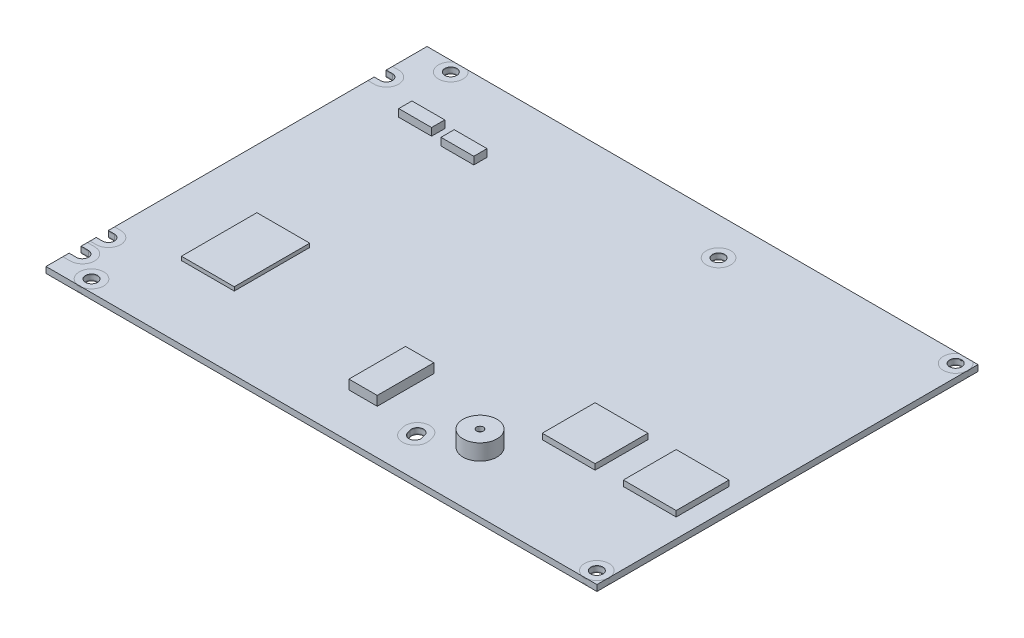
from build123d import *

# Parameters (mm, degrees)
CROQUIS1_R            = 1.6
EXTRUIR1_DEPTH        = 1.6
CROQUIS2_R            = 3.25
CORTAR_EXTRUIR1_DEPTH = 0.2
CROQUIS3_R            = 3.25
CROQUIS3_R_2          = 1.6
EXTRUIR2_DEPTH        = 0.2
EXTRUIR2_2_DEPTH      = 0.2
EXTRUIR2_3_DEPTH      = 0.2
EXTRUIR2_4_DEPTH      = 0.2
EXTRUIR2_5_DEPTH      = 0.2
EXTRUIR2_6_DEPTH      = 0.2
EXTRUIR2_7_DEPTH      = 0.2
EXTRUIR2_8_DEPTH      = 0.2
CROQUIS3_R_3          = 1.606150229
EXTRUIR2_9_DEPTH      = 0.2
CROQUIS4_W            = 14
CROQUIS4_H            = 20
EXTRUIR3_DEPTH        = 1
CROQUIS5_W            = 14
CROQUIS5_H            = 14
EXTRUIR4_DEPTH        = 1.5
EXTRUIR4_2_DEPTH      = 1.5
CROQUIS6_W            = 7.5
CROQUIS6_H            = 15
EXTRUIR5_DEPTH        = 2.5
CROQUIS7_R            = 1
CORTAR_EXTRUIR2_DEPTH = 0.2
CROQUIS8_W            = 8.7
CROQUIS8_H            = 3.5
EXTRUIR6_DEPTH        = 2
EXTRUIR6_2_DEPTH      = 2
CROQUIS9_R            = 4.5
EXTRUIR7_DEPTH        = 4.2
CROQUIS10_R           = 0.915294026
CORTAR_EXTRUIR3_DEPTH = 1.2


with BuildPart() as part:
    # Croquis1 → Extruir1 (new body)
    with BuildSketch(Plane(origin=(0, 0, 0), x_dir=(1, 0, 0), z_dir=(0, 1, 0))):
        with BuildLine():
            Line((0, -14.02), (0, -84.48))
            Line((0, -84.48), (1.64, -84.48))
            ThreePointArc((1.64, -84.48), (3.24, -86.08), (1.64, -87.68))
            Line((1.64, -87.68), (0, -87.68))
            Line((0, -87.68), (0, -91.68))
            Line((0, -91.68), (1.93, -91.68))
            ThreePointArc((1.93, -91.68), (3.53, -93.28), (1.93, -94.88))
            Line((1.93, -94.88), (0, -94.88))
            Line((0, -94.88), (0, -101))
            Line((0, -101), (146.04, -101))
            Line((146.04, -101), (146.04, 0))
            Line((146.04, 0), (0, 0))
            Line((0, 0), (0, -10.82))
            Line((0, -10.82), (1.64, -10.82))
            ThreePointArc((1.64, -10.82), (3.24, -12.42), (1.64, -14.02))
            Line((1.64, -14.02), (0, -14.02))
        make_face()
        with Locations(Location((8.99, -2.7, 0), (0, 0, 270))):
            Circle(CROQUIS1_R, mode=Mode.SUBTRACT)
        with Locations(Location((87.15, -9.88, 0), (0, 0, 270))):
            Circle(CROQUIS1_R, mode=Mode.SUBTRACT)
        with Locations(Location((142.8, -2.68, 0), (0, 0, 270))):
            Circle(CROQUIS1_R, mode=Mode.SUBTRACT)
        with Locations(Location((8.89, -97.82, 0), (0, 0, 270))):
            Circle(CROQUIS1_R, mode=Mode.SUBTRACT)
        with Locations(Location((142.8, -97.8, 0), (0, 0, 270))):
            Circle(CROQUIS1_R, mode=Mode.SUBTRACT)
        with BuildLine():
            Line((88.899048168, -89.45258631), (89.169048168, -90.40258631))
            ThreePointArc((89.169048168, -90.40258631), (88.06741369, -92.379048168), (86.090951832, -91.27741369))
            Line((86.090951832, -91.27741369), (85.820951832, -90.32741369))
            ThreePointArc((85.820951832, -90.32741369), (86.92258631, -88.350951832), (88.899048168, -89.45258631))
        make_face(mode=Mode.SUBTRACT)
    extrude(amount=EXTRUIR1_DEPTH)

    # Croquis2 → Cortar-Extruir1 (cut)
    with BuildSketch(Plane(origin=(0, 1.6, 0), x_dir=(1, 0, 0), z_dir=(0, 1, 0))):
        with Locations((8.99, -2.7)):
            Circle(CROQUIS2_R)
        with Locations((8.89, -97.82)):
            Circle(CROQUIS2_R)
        with Locations(Location((87.15, -9.88, 0), (0, 0, 270))):
            Circle(CROQUIS2_R)
        with Locations((142.8, -2.68)):
            Circle(CROQUIS2_R)
        with Locations((142.8, -97.8)):
            Circle(CROQUIS2_R)
        with BuildLine():
            Line((1.64, -9.17), (-2.325776784, -9.17))
            Line((-2.325776784, -9.17), (-2.325776784, -15.67))
            Line((-2.325776784, -15.67), (1.64, -15.67))
            ThreePointArc((1.64, -15.67), (4.89, -12.42), (1.64, -9.17))
        make_face()
        with BuildLine():
            Line((1.64, -82.83), (-3.18425811, -82.83))
            Line((-3.18425811, -82.83), (-3.18425811, -89.33))
            Line((-3.18425811, -89.33), (1.64, -89.33))
            ThreePointArc((1.64, -89.33), (4.89, -86.08), (1.64, -82.83))
        make_face()
        with BuildLine():
            Line((1.93, -90.03), (-3.18425811, -90.03))
            Line((-3.18425811, -90.03), (-3.18425811, -96.53))
            Line((-3.18425811, -96.53), (1.93, -96.53))
            ThreePointArc((1.93, -96.53), (5.18, -93.28), (1.93, -90.03))
        make_face()
        with BuildLine():
            Line((90.486191592, -89.001503442), (90.756191592, -89.951503442))
            ThreePointArc((90.756191592, -89.951503442), (88.518496558, -93.966191592), (84.503808408, -91.728496558))
            Line((84.503808408, -91.728496558), (84.233808408, -90.778496558))
            ThreePointArc((84.233808408, -90.778496558), (86.471503442, -86.763808408), (90.486191592, -89.001503442))
        make_face()
    cortar_extruir1 = extrude(amount=-CORTAR_EXTRUIR1_DEPTH, mode=Mode.SUBTRACT)

    # Simetría1: Cortar-Extruir1 across plane
    add(cortar_extruir1.mirror(Plane.ZX.offset(0.8)), mode=Mode.SUBTRACT)

    # Croquis7 → Cortar-Extruir2 (cut)
    with BuildSketch(Plane.XZ):
        with Locations(Location((17.46, 62.99, 0), (0, 0, 270))):
            Circle(CROQUIS7_R)
        with Locations(Location((57.62, 62.99, 0), (0, 0, 270))):
            Circle(CROQUIS7_R)
    extrude(amount=-CORTAR_EXTRUIR2_DEPTH, mode=Mode.SUBTRACT)


with BuildPart() as body_2:
    # Croquis3 → Extruir2 (new body)
    with BuildSketch(Plane(origin=(0, 1.4, 0), x_dir=(1, 0, 0), z_dir=(0, 1, 0))):
        with Locations(Location((87.15, -9.88, 0), (0, 0, 270))):
            Circle(CROQUIS3_R)
        with Locations(Location((87.15, -9.88, 0), (0, 0, 270))):
            Circle(CROQUIS3_R_2, mode=Mode.SUBTRACT)
    extrude(amount=EXTRUIR2_DEPTH)


with BuildPart() as body_3:
    # Croquis3 → Extruir2 2 (new body)
    with BuildSketch(Plane(origin=(0, 1.4, 0), x_dir=(1, 0, 0), z_dir=(0, 1, 0))):
        with BuildLine():
            Line((8.219105075, -101), (9.560894925, -101))
            ThreePointArc((9.560894925, -101), (8.89, -94.57), (8.219105075, -101))
        make_face()
        with Locations(Location((8.89, -97.82, 0), (0, 0, 270))):
            Circle(CROQUIS3_R_2, mode=Mode.SUBTRACT)
    extrude(amount=EXTRUIR2_2_DEPTH)


with BuildPart() as body_4:
    # Croquis3 → Extruir2 3 (new body)
    with BuildSketch(Plane(origin=(0, 1.4, 0), x_dir=(1, 0, 0), z_dir=(0, 1, 0))):
        with BuildLine():
            Line((0, -90.03), (0, -91.68))
            Line((0, -91.68), (1.93, -91.68))
            ThreePointArc((1.93, -91.68), (3.53, -93.28), (1.93, -94.88))
            Line((1.93, -94.88), (0, -94.88))
            Line((0, -94.88), (0, -96.53))
            Line((0, -96.53), (1.93, -96.53))
            ThreePointArc((1.93, -96.53), (5.18, -93.28), (1.93, -90.03))
            Line((1.93, -90.03), (0, -90.03))
        make_face()
    extrude(amount=EXTRUIR2_3_DEPTH)


with BuildPart() as body_5:
    # Croquis3 → Extruir2 4 (new body)
    with BuildSketch(Plane(origin=(0, 1.4, 0), x_dir=(1, 0, 0), z_dir=(0, 1, 0))):
        with BuildLine():
            Line((84.233808408, -90.778496558), (84.503808408, -91.728496558))
            ThreePointArc((84.503808408, -91.728496558), (88.518496558, -93.966191592), (90.756191592, -89.951503442))
            Line((90.756191592, -89.951503442), (90.486191592, -89.001503442))
            ThreePointArc((90.486191592, -89.001503442), (86.471503442, -86.763808408), (84.233808408, -90.778496558))
        make_face()
        with BuildLine():
            Line((85.820951832, -90.32741369), (86.090951832, -91.27741369))
            ThreePointArc((86.090951832, -91.27741369), (88.06741369, -92.379048168), (89.169048168, -90.40258631))
            Line((89.169048168, -90.40258631), (88.899048168, -89.45258631))
            ThreePointArc((88.899048168, -89.45258631), (86.92258631, -88.350951832), (85.820951832, -90.32741369))
        make_face(mode=Mode.SUBTRACT)
    extrude(amount=EXTRUIR2_4_DEPTH)


with BuildPart() as body_6:
    # Croquis3 → Extruir2 5 (new body)
    with BuildSketch(Plane(origin=(0, 1.4, 0), x_dir=(1, 0, 0), z_dir=(0, 1, 0))):
        with BuildLine():
            Line((0, -82.83), (0, -84.48))
            Line((0, -84.48), (1.64, -84.48))
            ThreePointArc((1.64, -84.48), (3.24, -86.08), (1.64, -87.68))
            Line((1.64, -87.68), (0, -87.68))
            Line((0, -87.68), (0, -89.33))
            Line((0, -89.33), (1.64, -89.33))
            ThreePointArc((1.64, -89.33), (4.89, -86.08), (1.64, -82.83))
            Line((1.64, -82.83), (0, -82.83))
        make_face()
    extrude(amount=EXTRUIR2_5_DEPTH)


with BuildPart() as body_7:
    # Croquis3 → Extruir2 6 (new body)
    with BuildSketch(Plane(origin=(0, 1.4, 0), x_dir=(1, 0, 0), z_dir=(0, 1, 0))):
        with BuildLine():
            Line((142.232109165, -101), (143.367890835, -101))
            ThreePointArc((143.367890835, -101), (145.206995118, -99.983775287), (146.04, -98.054754784))
            Line((146.04, -98.054754784), (146.04, -97.545245216))
            ThreePointArc((146.04, -97.545245216), (140.616224713, -95.393004882), (142.232109165, -101))
        make_face()
        with Locations(Location((142.8, -97.8, 0), (0, 0, 270))):
            Circle(CROQUIS3_R_2, mode=Mode.SUBTRACT)
    extrude(amount=EXTRUIR2_6_DEPTH)


with BuildPart() as body_8:
    # Croquis3 → Extruir2 7 (new body)
    with BuildSketch(Plane(origin=(0, 1.4, 0), x_dir=(1, 0, 0), z_dir=(0, 1, 0))):
        with BuildLine():
            Line((10.799005252, 0), (7.180994748, 0))
            ThreePointArc((7.180994748, 0), (8.99, -5.95), (10.799005252, 0))
        make_face()
        with Locations(Location((8.99, -2.7, 0), (0, 0, 270))):
            Circle(CROQUIS3_R_2, mode=Mode.SUBTRACT)
    extrude(amount=EXTRUIR2_7_DEPTH)


with BuildPart() as body_9:
    # Croquis3 → Extruir2 8 (new body)
    with BuildSketch(Plane(origin=(0, 1.4, 0), x_dir=(1, 0, 0), z_dir=(0, 1, 0))):
        with BuildLine():
            Line((0, -9.17), (0, -10.82))
            Line((0, -10.82), (1.64, -10.82))
            ThreePointArc((1.64, -10.82), (3.24, -12.42), (1.64, -14.02))
            Line((1.64, -14.02), (0, -14.02))
            Line((0, -14.02), (0, -15.67))
            Line((0, -15.67), (1.64, -15.67))
            ThreePointArc((1.64, -15.67), (4.89, -12.42), (1.64, -9.17))
            Line((1.64, -9.17), (0, -9.17))
        make_face()
    extrude(amount=EXTRUIR2_8_DEPTH)


with BuildPart() as body_10:
    # Croquis3 → Extruir2 9 (new body)
    with BuildSketch(Plane(origin=(0, 1.4, 0), x_dir=(1, 0, 0), z_dir=(0, 1, 0))):
        with BuildLine():
            Line((146.04, -2.934754784), (146.04, -2.425245216))
            ThreePointArc((146.04, -2.425245216), (145.61393966, -1.053886969), (144.638504827, 0))
            Line((144.638504827, 0), (140.961495173, 0))
            ThreePointArc((140.961495173, 0), (141.173886969, -5.49393966), (146.04, -2.934754784))
        make_face()
        with Locations(Location((142.8, -2.68, 0), (0, 0, 270))):
            Circle(CROQUIS3_R_3, mode=Mode.SUBTRACT)
    extrude(amount=EXTRUIR2_9_DEPTH)


with BuildPart() as body_11:
    # Simetría2: mirrored copy
    add(body_4.part.mirror(Plane.ZX.offset(0.8)))


with BuildPart() as body_12:
    # Simetr_a2 2: mirrored copy
    add(body_6.part.mirror(Plane.ZX.offset(0.8)))


with BuildPart() as body_13:
    # Simetr_a2 3: mirrored copy
    add(body_3.part.mirror(Plane.ZX.offset(0.8)))


with BuildPart() as body_14:
    # Simetr_a2 4: mirrored copy
    add(body_8.part.mirror(Plane.ZX.offset(0.8)))


with BuildPart() as body_15:
    # Simetr_a2 5: mirrored copy
    add(body_9.part.mirror(Plane.ZX.offset(0.8)))


with BuildPart() as body_16:
    # Simetr_a2 6: mirrored copy
    add(body_7.part.mirror(Plane.ZX.offset(0.8)))


with BuildPart() as body_17:
    # Simetr_a2 7: mirrored copy
    add(body_5.part.mirror(Plane.ZX.offset(0.8)))


with BuildPart() as body_18:
    # Simetr_a2 8: mirrored copy
    add(body_2.part.mirror(Plane.ZX.offset(0.8)))


with BuildPart() as body_19:
    # Simetr_a2 9: mirrored copy
    add(body_10.part.mirror(Plane.ZX.offset(0.8)))


with BuildPart() as body_20:
    # Croquis4 → Extruir3 (new body)
    with BuildSketch(Plane(origin=(0, 1.6, 0), x_dir=(1, 0, 0), z_dir=(0, 1, 0))):
        with Locations((23.6, -71.7)):
            Rectangle(CROQUIS4_W, CROQUIS4_H)
    extrude(amount=EXTRUIR3_DEPTH)


with BuildPart() as body_21:
    # Croquis5 → Extruir4 (new body)
    with BuildSketch(Plane(origin=(0, 1.6, 0), x_dir=(1, 0, 0), z_dir=(0, 1, 0))):
        with Locations((112.54, -68)):
            Rectangle(CROQUIS5_W, CROQUIS5_H)
    extrude(amount=EXTRUIR4_DEPTH)


with BuildPart() as body_22:
    # Croquis5 → Extruir4 2 (new body)
    with BuildSketch(Plane(origin=(0, 1.6, 0), x_dir=(1, 0, 0), z_dir=(0, 1, 0))):
        with Locations((134.04, -68)):
            Rectangle(CROQUIS5_W, CROQUIS5_H)
    extrude(amount=EXTRUIR4_2_DEPTH)


with BuildPart() as body_23:
    # Croquis6 → Extruir5 (new body)
    with BuildSketch(Plane(origin=(0, 1.6, 0), x_dir=(1, 0, 0), z_dir=(0, 1, 0))):
        with Locations((72.25, -81.7)):
            Rectangle(CROQUIS6_W, CROQUIS6_H)
    extrude(amount=EXTRUIR5_DEPTH)


with BuildPart() as body_24:
    # Croquis8 → Extruir6 (new body)
    with BuildSketch(Plane(origin=(0, 1.6, 0), x_dir=(1, 0, 0), z_dir=(0, 1, 0))):
        with Locations((29.05, -19.25)):
            Rectangle(CROQUIS8_W, CROQUIS8_H)
    extrude(amount=EXTRUIR6_DEPTH)


with BuildPart() as body_25:
    # Croquis8 → Extruir6 2 (new body)
    with BuildSketch(Plane(origin=(0, 1.6, 0), x_dir=(1, 0, 0), z_dir=(0, 1, 0))):
        with Locations((16.85, -18.25)):
            Rectangle(CROQUIS8_W, CROQUIS8_H)
    extrude(amount=EXTRUIR6_2_DEPTH)


with BuildPart() as body_26:
    # Croquis9 → Extruir7 (new body)
    with BuildSketch(Plane(origin=(0, 1.6, 0), x_dir=(1, 0, 0), z_dir=(0, 1, 0))):
        with Locations(Location((99.04, -85, 0), (0, 0, 270))):
            Circle(CROQUIS9_R)
    extrude(amount=EXTRUIR7_DEPTH)

    # Croquis10 → Cortar-Extruir3 (cut)
    with BuildSketch(Plane(origin=(0, 5.8, 0), x_dir=(1, 0, 0), z_dir=(0, 1, 0))):
        with Locations(Location((99.04, -85, 0), (0, 0, 270))):
            Circle(CROQUIS10_R)
    extrude(amount=-CORTAR_EXTRUIR3_DEPTH, mode=Mode.SUBTRACT)


solid = Compound([part.part, body_2.part, body_3.part, body_4.part, body_5.part, body_6.part, body_7.part, body_8.part, body_9.part, body_10.part, body_11.part, body_12.part, body_13.part, body_14.part, body_15.part, body_16.part, body_17.part, body_18.part, body_19.part, body_20.part, body_21.part, body_22.part, body_23.part, body_24.part, body_25.part, body_26.part])
